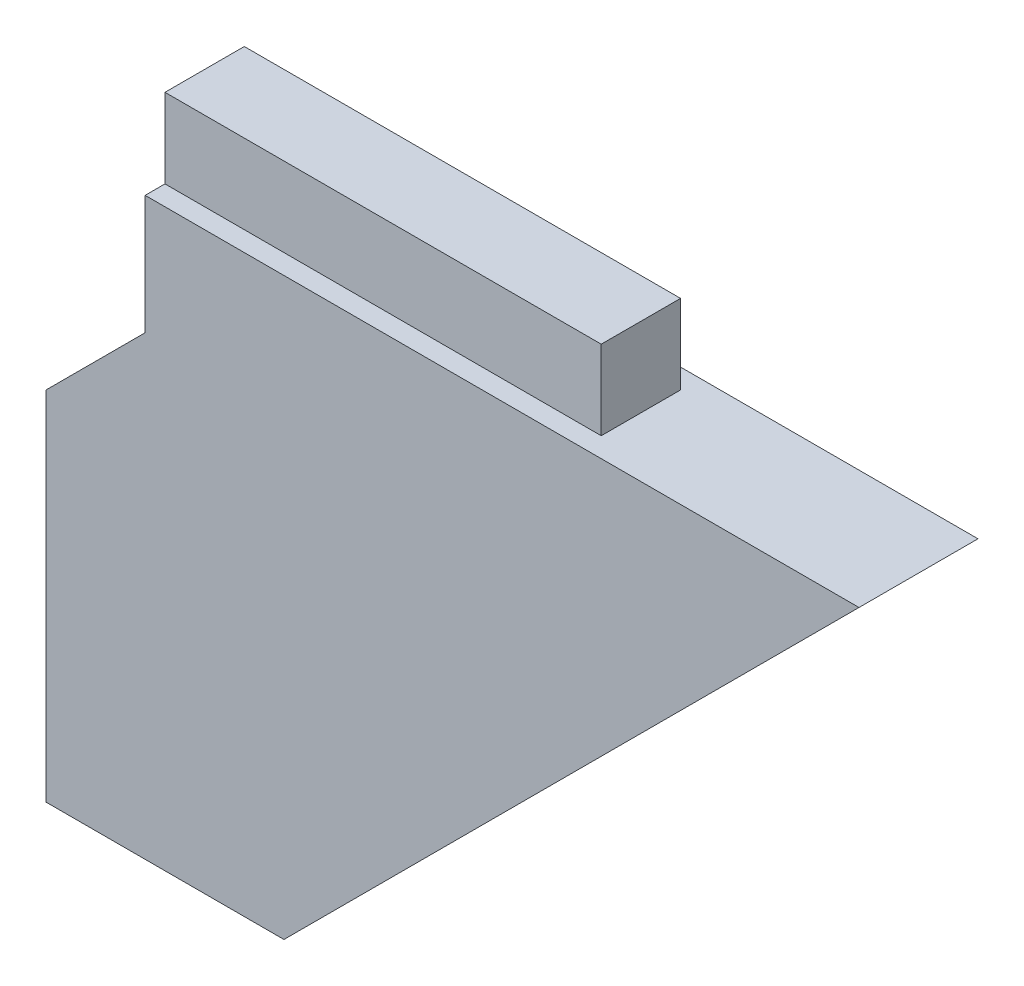
from build123d import *

# Parameters (mm, degrees)
BOSS_EXTRUDE1_DEPTH = 1.5
SKETCH1_4_W         = 11
SKETCH1_4_H         = 2
BOSS_EXTRUDE2_DEPTH = 1


with BuildPart() as part:
    # Sketch1 → Boss-Extrude1 (new, symmetric)
    with BuildSketch(Plane.XY):
        Polygon((-28.5, -6), (-39.5, -6), (-39.5, -9), (-42, -11.5), (-42, -20.5), (-36, -20.5), (-24.008925726, -8.508925726), (-21.5, -6), align=None)
    extrude(amount=BOSS_EXTRUDE1_DEPTH, both=True)

    # Sketch1<4> → Boss-Extrude2 (add, symmetric)
    with BuildSketch(Plane.XY):
        with Locations((-34, -5)):
            Rectangle(SKETCH1_4_W, SKETCH1_4_H)
    extrude(amount=BOSS_EXTRUDE2_DEPTH, both=True)


solid = part.part
